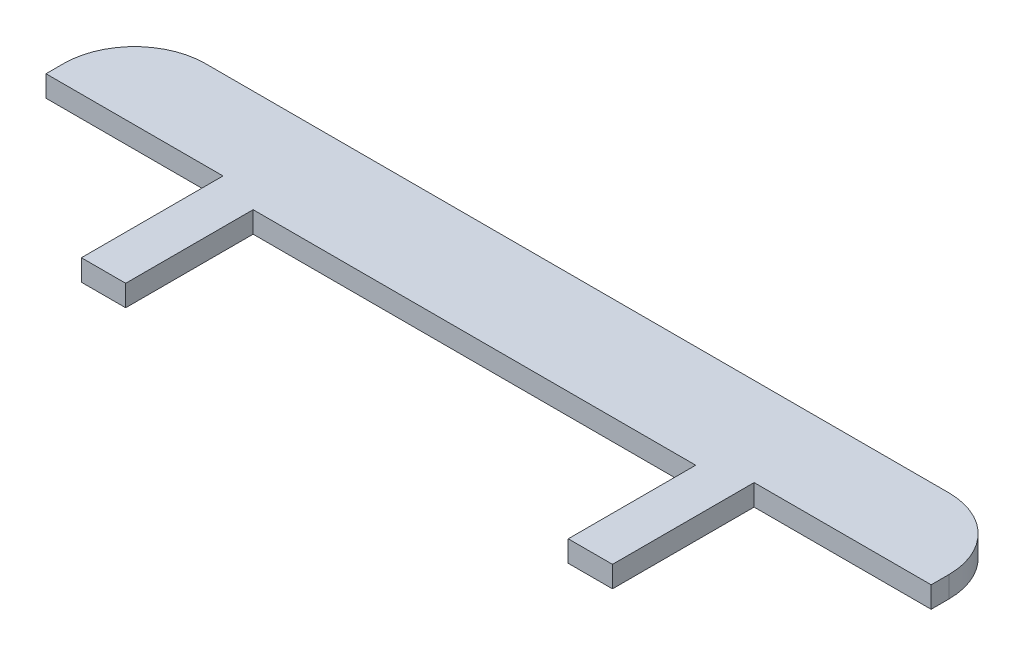
from build123d import *

# Parameters (mm, degrees)
BOSS_EXTRUDE1_DEPTH = 1.524
FILLET1_R           = 5.08


with BuildPart() as part:
    # Sketch1 → Boss-Extrude1 (new body)
    with BuildSketch(Plane(origin=(0, 0, 0), x_dir=(1, 0, 0), z_dir=(0, 1, 0))):
        Polygon((19.05, 0), (31.75, 0), (31.75, 6.35), (-31.75, 6.35), (-31.75, 0), (-19.05, 0), (-19.05, -10.16), (-15.875, -10.16), (-15.875, -1.016), (15.875, -1.016), (15.875, -10.16), (19.05, -10.16), align=None)
    extrude(amount=BOSS_EXTRUDE1_DEPTH)

    # Fillet1
    fillet1_edges = [part.edges().sort_by_distance(p)[0] for p in [
        (-31.75, 0.762, -6.35),
        (31.75, 0.762, -6.35),
    ]]
    fillet(fillet1_edges, radius=FILLET1_R)


solid = part.part
